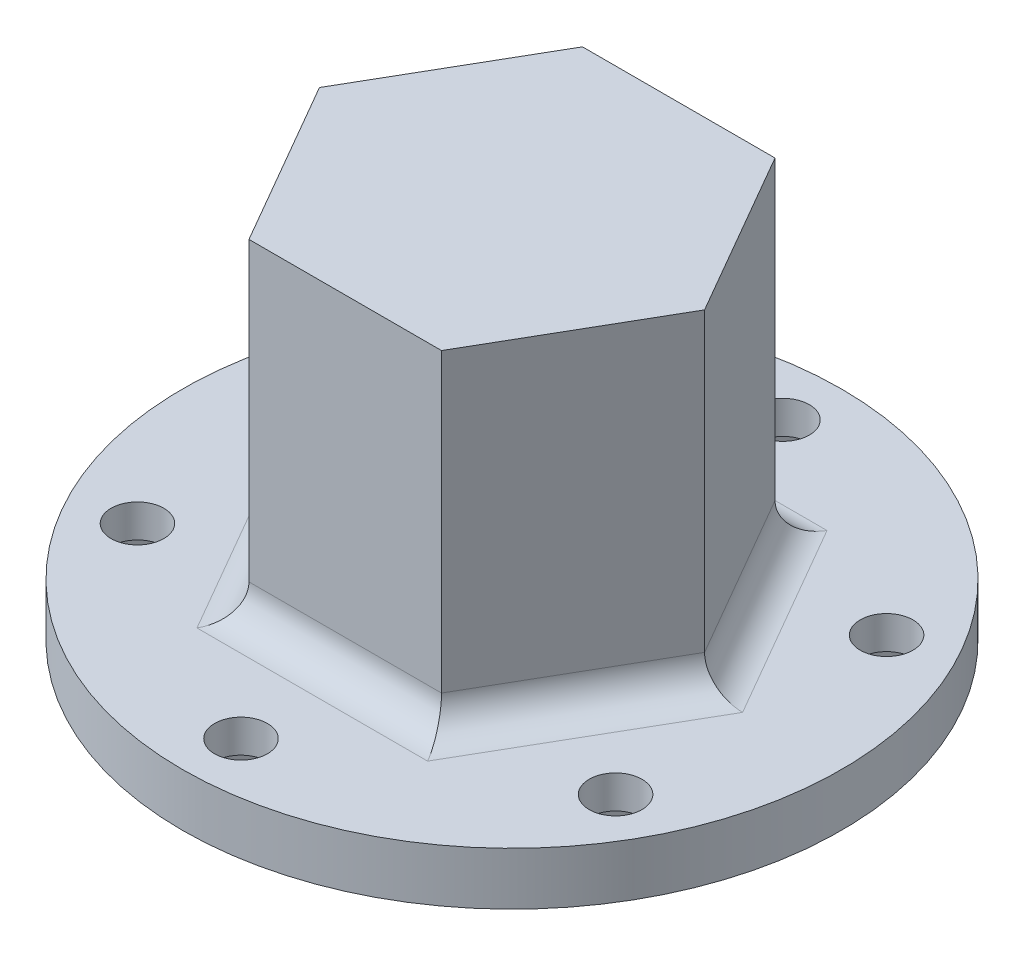
from build123d import *

# Parameters (mm, degrees)
BOSS_EXTRUDE1_DEPTH = 50
BOSS_EXTRUDE2_DEPTH = 5
SKETCH3_R           = 50
BOSS_EXTRUDE3_DEPTH = 5
FILLET1_R           = 5
BOSS_EXTRUDE4_START = 3
SKETCH5_R           = 50
BOSS_EXTRUDE4_DEPTH = 3
SKETCH5_3_R         = 4
CUT_EXTRUDE1_DEPTH  = 10


with BuildPart() as part:
    # Sketch1 → Boss-Extrude1 (new body)
    with BuildSketch(Plane(origin=(0, 0, 0), x_dir=(1, 0, 0), z_dir=(0, 1, 0))):
        Polygon((-29.213923621, 0), (-14.60696181, -25.3), (14.60696181, -25.3), (29.213923621, 0), (14.60696181, 25.3), (-14.60696181, 25.3), align=None)
        Polygon((23.440420929, 0), (11.720210465, -20.3), (-11.720210465, -20.3), (-23.440420929, 0), (-11.720210465, 20.3), (11.720210465, 20.3), align=None, mode=Mode.SUBTRACT)
    extrude(amount=BOSS_EXTRUDE1_DEPTH)

    # Sketch2 → Boss-Extrude2 (add)
    with BuildSketch(Plane(origin=(0, 50, 0), x_dir=(1, 0, 0), z_dir=(0, 1, 0))):
        Polygon((-14.60696181, 25.3), (-29.213923621, 0), (-14.60696181, -25.3), (14.60696181, -25.3), (29.213923621, 0), (14.60696181, 25.3), align=None)
    extrude(amount=BOSS_EXTRUDE2_DEPTH)

    # Sketch3 → Boss-Extrude3 (add)
    with BuildSketch(Plane.XZ):
        Circle(SKETCH3_R)
        Polygon((23.440420929, 0), (11.720210465, -20.3), (-11.720210465, -20.3), (-23.440420929, 0), (-11.720210465, 20.3), (11.720210465, 20.3), align=None, mode=Mode.SUBTRACT)
    extrude(amount=-BOSS_EXTRUDE3_DEPTH)

    # Fillet1
    fillet1_edges = [part.edges().sort_by_distance(p)[0] for p in [
        (0, 5, 25.3),
        (21.910442716, 5, 12.65),
        (21.910442716, 5, -12.65),
        (0, 5, -25.3),
        (-21.910442716, 5, 12.65),
        (-21.910442716, 5, -12.65),
    ]]
    fillet(fillet1_edges, radius=FILLET1_R)

    # Sketch5 → Boss-Extrude4 (add)
    with BuildSketch(Plane.XZ.offset(BOSS_EXTRUDE4_START)):
        Circle(SKETCH5_R)
        Polygon((-4.252388339, -34.798222074), (3.484105268, -34.798222074), (7.352352072, -41.498222074), (3.484105268, -48.198222074), (-4.252388339, -48.198222074), (-8.120635142, -41.498222074), align=None, mode=Mode.SUBTRACT)
        Polygon((-32.262338492, -13.716434709), (-28.394091688, -20.416434709), (-32.262338492, -27.116434709), (-39.998832099, -27.116434709), (-43.867078902, -20.416434709), (-39.998832099, -13.716434709), align=None, mode=Mode.SUBTRACT)
        Polygon((28.009950153, -21.081787365), (31.878196957, -14.381787365), (39.614690564, -14.381787365), (43.482937367, -21.081787365), (39.614690564, -27.781787365), (31.878196957, -27.781787365), align=None, mode=Mode.SUBTRACT)
        Polygon((-28.009950153, 21.081787365), (-31.878196957, 14.381787365), (-39.614690564, 14.381787365), (-43.482937367, 21.081787365), (-39.614690564, 27.781787365), (-31.878196957, 27.781787365), align=None, mode=Mode.SUBTRACT)
        Polygon((-23.440420929, 0), (-11.720210465, 20.3), (11.720210465, 20.3), (23.440420929, 0), (11.720210465, -20.3), (-11.720210465, -20.3), align=None, mode=Mode.SUBTRACT)
        Polygon((32.262338492, 13.716434709), (28.394091688, 20.416434709), (32.262338492, 27.116434709), (39.998832099, 27.116434709), (43.867078902, 20.416434709), (39.998832099, 13.716434709), align=None, mode=Mode.SUBTRACT)
        Polygon((4.252388339, 34.798222074), (-3.484105268, 34.798222074), (-7.352352072, 41.498222074), (-3.484105268, 48.198222074), (4.252388339, 48.198222074), (8.120635142, 41.498222074), align=None, mode=Mode.SUBTRACT)
    extrude(amount=-BOSS_EXTRUDE4_DEPTH)

    # Sketch5<3> → Cut-Extrude1 (cut)
    with BuildSketch(Plane.XZ):
        with Locations((0.384141535, 41.498222074)):
            Circle(SKETCH5_3_R)
        with Locations((36.130585295, 20.416434709)):
            Circle(SKETCH5_3_R)
        with Locations((35.74644376, -21.081787365)):
            Circle(SKETCH5_3_R)
        with Locations((-0.384141535, -41.498222074)):
            Circle(SKETCH5_3_R)
        with Locations((-36.130585295, -20.416434709)):
            Circle(SKETCH5_3_R)
        with Locations((-35.74644376, 21.081787365)):
            Circle(SKETCH5_3_R)
    extrude(amount=-CUT_EXTRUDE1_DEPTH, mode=Mode.SUBTRACT)


solid = part.part
